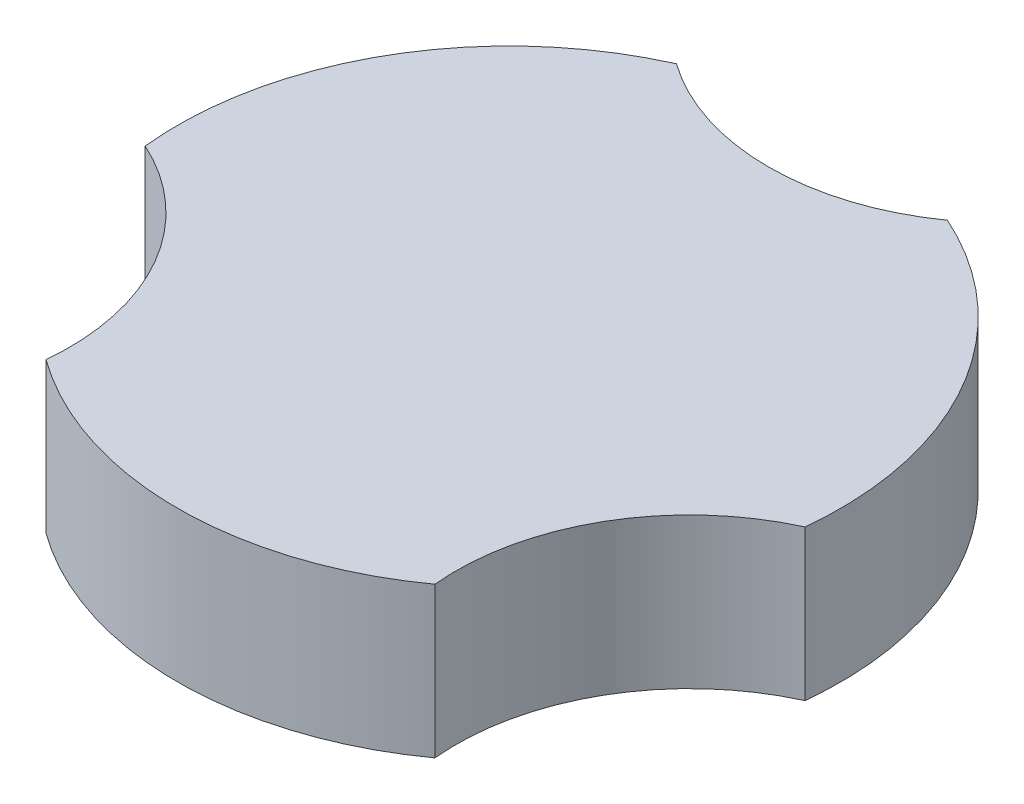
from build123d import *

# Parameters (mm, degrees)
BOSS_EXTRUDE1_DEPTH = 6.35


with BuildPart() as part:
    # Sketch1 → Boss-Extrude1 (new body)
    with BuildSketch(Plane(origin=(0, 0, 0), x_dir=(1, 0, 0), z_dir=(0, 1, 0))):
        with BuildLine():
            ThreePointArc((13.925943024, -1.438092792), (13.981473498, -0.719999187), (14, 0))
            ThreePointArc((14, 0), (11.748311638, 7.614274335), (5.717546621, 12.779266827))
            ThreePointArc((5.717546621, 12.779266827), (0, 10.95), (-5.717546621, 12.779266827))
            ThreePointArc((-5.717546621, 12.779266827), (-12.124355653, 7), (-13.925943024, -1.438092792))
            ThreePointArc((-13.925943024, -1.438092792), (-9.728304381, -5.072629445), (-8.163328399, -10.4))
            ThreePointArc((-8.163328399, -10.4), (-8.174601851, -10.871126227), (-8.208396403, -11.341174035))
            ThreePointArc((-8.208396403, -11.341174035), (0, -14), (8.208396403, -11.341174035))
            ThreePointArc((8.208396403, -11.341174035), (9.482978171, -5.475), (13.925943024, -1.438092792))
        make_face()
    extrude(amount=BOSS_EXTRUDE1_DEPTH)


solid = part.part
